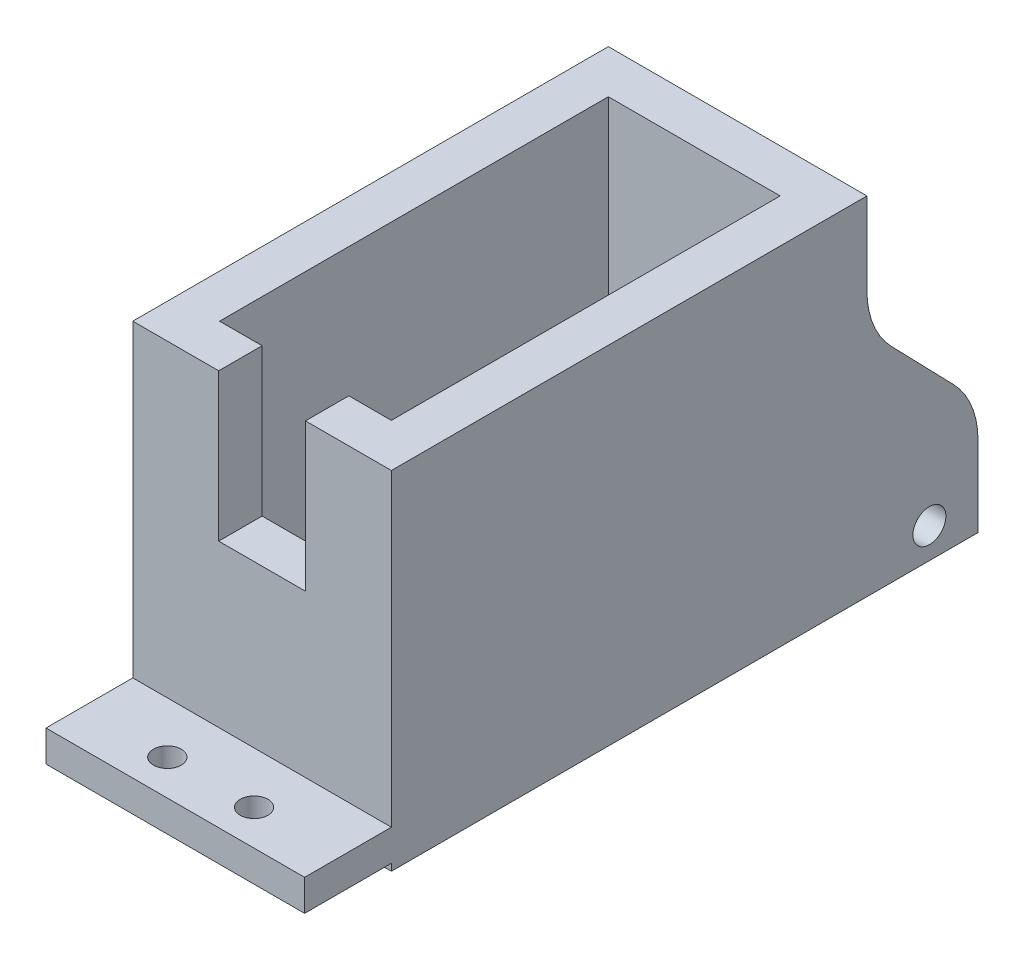
from build123d import *

# Parameters (mm, degrees)
BOSS_EXTRUDE1_DEPTH = 50.8
CUT_EXTRUDE1_DEPTH  = 50.8
SKETCH5_R           = 2.032
BOSS_EXTRUDE2_DEPTH = 4.572
SKETCH8_R           = 2.413
BOSS_EXTRUDE3_DEPTH = 37.846
FILLET1_R           = 12.7


with BuildPart() as part:
    # Sketch1 → Boss-Extrude1 (new body)
    with BuildSketch(Plane(origin=(0, 0, 0), x_dir=(1, 0, 0), z_dir=(0, 1, 0))):
        Polygon((-0.528142549, -56.463008639), (-0.528142549, -28.015008639), (-6.878142549, -28.015008639), (-6.878142549, -62.813008639), (12.044857451, -62.813008639), (12.044857451, -56.463008639), align=None)
        Polygon((-0.528142549, -28.015008639), (-0.528142549, 0.432991361), (12.044857451, 0.432991361), (12.044857451, 6.782991361), (-6.878142549, 6.782991361), (-6.878142549, -28.015008639), align=None)
        Polygon((12.044857451, 6.782991361), (12.044857451, 0.432991361), (24.617857451, 0.432991361), (24.617857451, -28.015008639), (30.967857451, -28.015008639), (30.967857451, 6.782991361), align=None)
        Polygon((24.617857451, -56.463008639), (12.044857451, -56.463008639), (12.044857451, -62.813008639), (30.967857451, -62.813008639), (30.967857451, -28.015008639), (24.617857451, -28.015008639), align=None)
    extrude(amount=BOSS_EXTRUDE1_DEPTH)

    # Sketch3 → Cut-Extrude1 (cut)
    with BuildSketch(Plane.XY.offset(62.813008639)):
        Polygon((5.694857451, 29.21), (12.044857451, 29.21), (18.394857451, 29.21), (18.394857451, 50.8), (5.694857451, 50.8), align=None)
    extrude(amount=-CUT_EXTRUDE1_DEPTH, mode=Mode.SUBTRACT)

    # Sketch5 → Boss-Extrude2 (add)
    with BuildSketch(Plane(origin=(0, 1.016, 0), x_dir=(1, 0, 0), z_dir=(0, 1, 0))):
        Polygon((30.967857451, -62.813008639), (12.044857451, -62.813008639), (-6.878142549, -62.813008639), (-6.878142549, -75.513008639), (30.967857451, -75.513008639), align=None)
        with Locations(Location((5.694857451, -70.332821617, 0), (0, 0, 270))):
            Circle(SKETCH5_R, mode=Mode.SUBTRACT)
        with Locations(Location((18.394857451, -70.332821617, 0), (0, 0, 270))):
            Circle(SKETCH5_R, mode=Mode.SUBTRACT)
    extrude(amount=BOSS_EXTRUDE2_DEPTH)

    # Sketch8 → Boss-Extrude3 (add)
    with BuildSketch(Plane(origin=(30.967857451, 0, 0), x_dir=(0, 0, -1), z_dir=(1, 0, 0))):
        Polygon((6.782991361, 0), (15.926991361, 0), (23.037514196, 0), (23.037514196, 16.864021844), (6.782991361, 33.63258694), align=None)
        with Locations((15.926991361, 4.445)):
            Circle(SKETCH8_R, mode=Mode.SUBTRACT)
    extrude(amount=-BOSS_EXTRUDE3_DEPTH)

    # Fillet1
    fillet1_edges = [part.edges().sort_by_distance(p)[0] for p in [
        (12.044857451, 33.63258694, -6.782991361),
        (12.044857451, 16.864021844, -23.037514196),
    ]]
    fillet(fillet1_edges, radius=FILLET1_R)


solid = part.part
